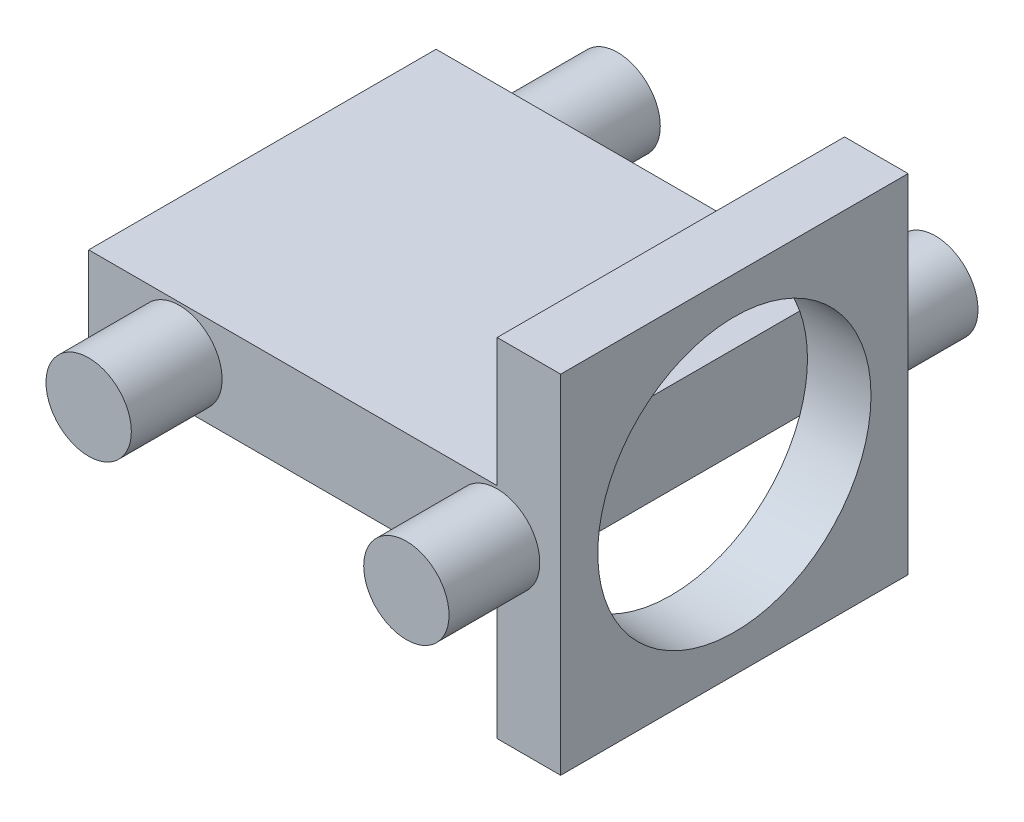
from build123d import *

# Parameters (mm, degrees)
SKETCH1_W           = 38.275
SKETCH1_H           = 38.275
SKETCH1_R           = 15.05
BOSS_EXTRUDE1_DEPTH = 7
SKETCH2_W           = 38.275
SKETCH2_H           = 10
BOSS_EXTRUDE2_DEPTH = 45
SKETCH3_R           = 4.7
BOSS_EXTRUDE3_DEPTH = 10


with BuildPart() as part:
    # Sketch1 → Boss-Extrude1 (new body)
    with BuildSketch(Plane(origin=(0, 0, 0), x_dir=(0, 0, -1), z_dir=(1, 0, 0))):
        Rectangle(SKETCH1_W, SKETCH1_H)
        Circle(SKETCH1_R, mode=Mode.SUBTRACT)
    extrude(amount=BOSS_EXTRUDE1_DEPTH)

    # Sketch2 → Boss-Extrude2 (add)
    with BuildSketch(Plane.ZY):
        Rectangle(SKETCH2_W, SKETCH2_H)
    extrude(amount=BOSS_EXTRUDE2_DEPTH)

    # Sketch3 → Boss-Extrude3 (add)
    with BuildSketch(Plane.XY.offset(19.1375)):
        with Locations(Location((-35, 0, 0), (0, 0, 180))):
            Circle(SKETCH3_R)
        with Locations(Location((0, 0, 0), (0, 0, 180))):
            Circle(SKETCH3_R)
    boss_extrude3 = extrude(amount=BOSS_EXTRUDE3_DEPTH)

    # Mirror1: Boss-Extrude3 across plane
    add(boss_extrude3.mirror(Plane.XY))


solid = part.part
